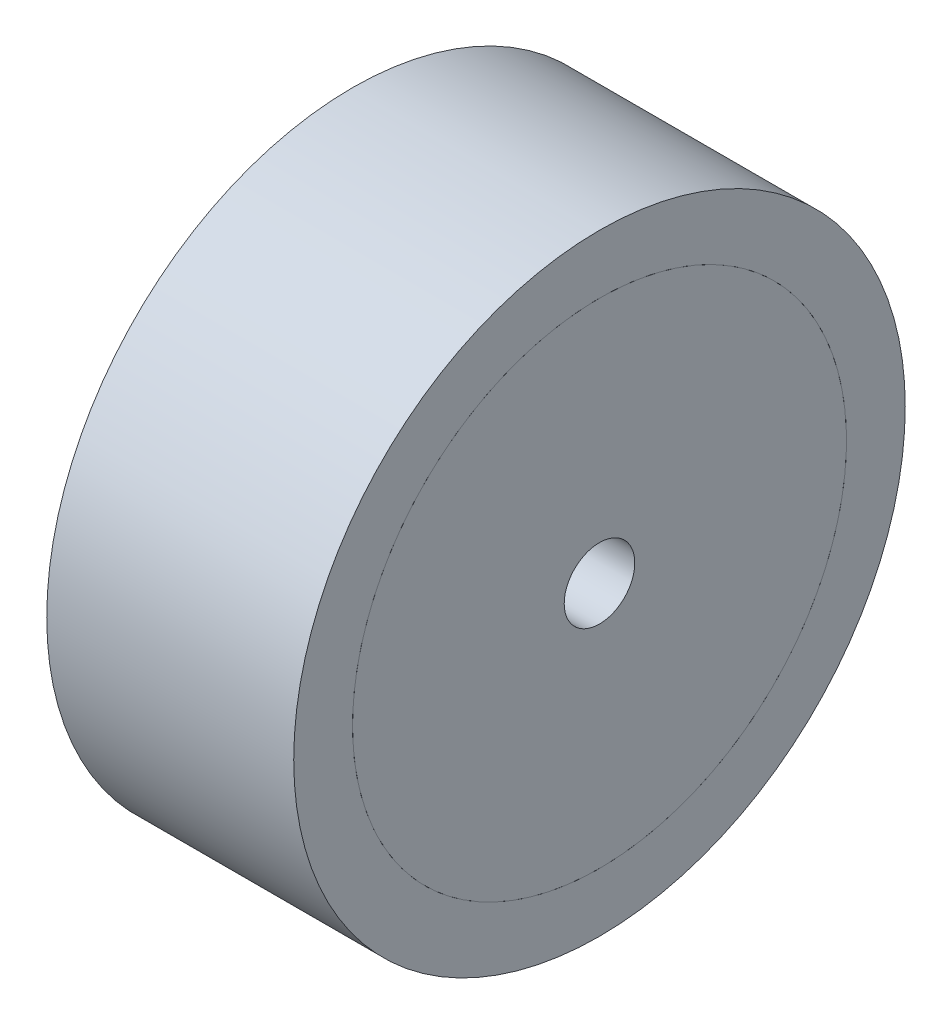
from build123d import *

# Parameters (mm, degrees)
SKETCH1_R           = 21
SKETCH1_R_2         = 3
BOSS_EXTRUDE1_DEPTH = 21
SKETCH2_R           = 26
SKETCH2_R_2         = 21
BOSS_EXTRUDE2_DEPTH = 21


with BuildPart() as part:
    # Sketch1 → Boss-Extrude1 (new body)
    with BuildSketch(Plane(origin=(0, 0, 0), x_dir=(0, 0, -1), z_dir=(1, 0, 0))):
        with Locations(Location((0, 0, 0), (0, 0, 180))):
            Circle(SKETCH1_R)
        with Locations(Location((0, 0, 0), (0, 0, 180))):
            Circle(SKETCH1_R_2, mode=Mode.SUBTRACT)
    extrude(amount=BOSS_EXTRUDE1_DEPTH)


with BuildPart() as body_2:
    # Sketch2 → Boss-Extrude2 (new body)
    with BuildSketch(Plane(origin=(21, 0, 0), x_dir=(0, 0, -1), z_dir=(1, 0, 0))):
        Circle(SKETCH2_R)
        Circle(SKETCH2_R_2, mode=Mode.SUBTRACT)
    extrude(amount=-BOSS_EXTRUDE2_DEPTH)


solid = Compound([part.part, body_2.part])
